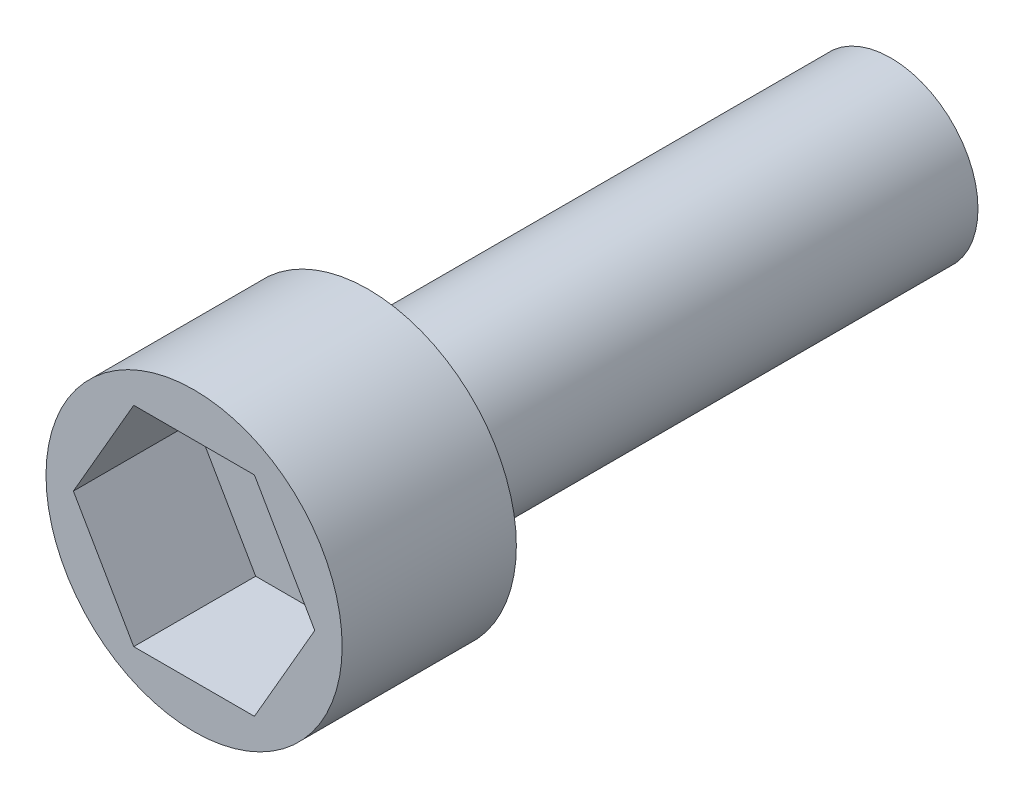
from build123d import *

# Parameters (mm, degrees)
ESQUISSE1_R             = 2.5
BOSS_EXTRU_1_DEPTH      = 15
ESQUISSE2_R             = 4.25
BOSS_EXTRU_2_DEPTH      = 5
ENL_V_MAT_EXTRU_1_DEPTH = 3.5


with BuildPart() as part:
    # Esquisse1 → Boss.-Extru.1 (new body)
    with BuildSketch(Plane.XY):
        Circle(ESQUISSE1_R)
    extrude(amount=BOSS_EXTRU_1_DEPTH)

    # Esquisse2 → Boss.-Extru.2 (add)
    with BuildSketch(Plane.XY.offset(15)):
        Circle(ESQUISSE2_R)
    extrude(amount=BOSS_EXTRU_2_DEPTH)

    # Esquisse3 → Enlèv. mat.-Extru.1 (cut)
    with BuildSketch(Plane.XY.offset(20)):
        Polygon((3.464101615, 0), (1.732050808, 3), (-1.732050808, 3), (-3.464101615, 0), (-1.732050808, -3), (1.732050808, -3), align=None)
    extrude(amount=-ENL_V_MAT_EXTRU_1_DEPTH, mode=Mode.SUBTRACT)


solid = part.part
